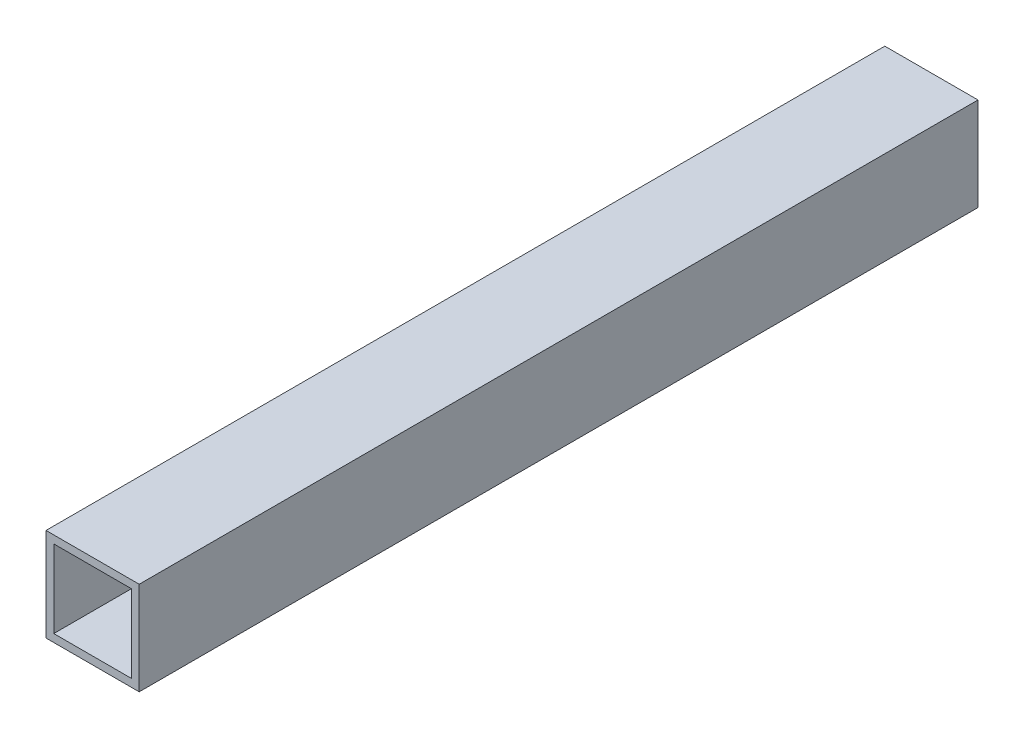
from build123d import *

# Parameters (mm, degrees)
SKETCH_1_W      = 24
SKETCH_1_H      = 24
SKETCH_1_W_2    = 20
SKETCH_1_H_2    = 20
EXTRUDE_1_DEPTH = 216


with BuildPart() as part:
    # 草图1 → 凸台-拉伸1 (new body)
    with BuildSketch(Plane.XY):
        Rectangle(SKETCH_1_W, SKETCH_1_H)
        Rectangle(SKETCH_1_W_2, SKETCH_1_H_2, mode=Mode.SUBTRACT)
    extrude(amount=EXTRUDE_1_DEPTH)


solid = part.part
